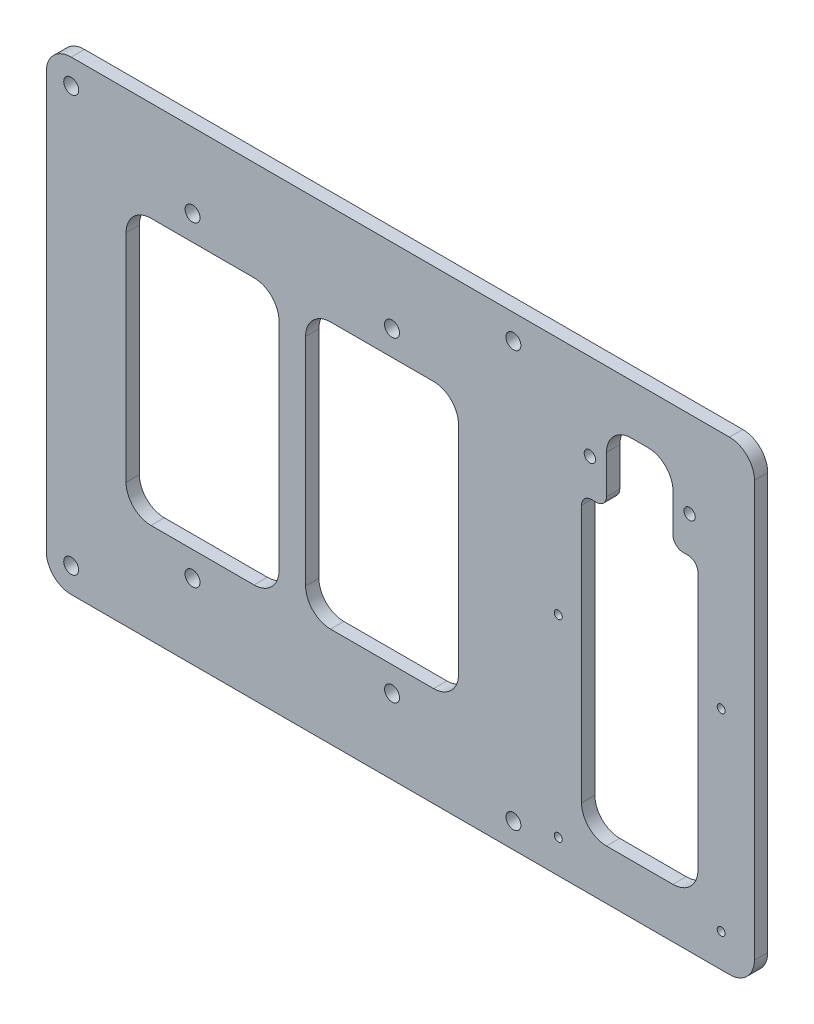
from build123d import *

# Parameters (mm, degrees)
SKETCH_1_W              = 140
SKETCH_1_H              = 148
SKETCH_1_W_2            = 80
SKETCH_1_H_2            = 46
EXTRUDE_1_DEPTH         = 4
HOLE_WIZARD_M4_1_D      = 4.5
HOLE_WIZARD_4_5_4_5_1_D = 4.5
SKETCH_9_W              = 65
SKETCH_9_H              = 140
EXTRUDE_3_DEPTH         = 4
HOLE_WIZARD_M2_1_D      = 2.4
CUT_EXTRUDE_1_DEPTH     = 255.921556562
HOLE_WIZARD_M3_1_D      = 3.4
FILLET_6_R              = 7.5
FILLET_8_R              = 3


with BuildPart() as part:
    # ｽｹｯﾁ1 → ﾎﾞｽ - 押し出し1 (new body)
    with BuildSketch(Plane(origin=(0, 0, 0), x_dir=(0, 1, 0), z_dir=(0, 0, 1))):
        with Locations((70, -74)):
            Rectangle(SKETCH_1_W, SKETCH_1_H)
        with Locations((70, -47)):
            Rectangle(SKETCH_1_W_2, SKETCH_1_H_2, mode=Mode.SUBTRACT)
        with Locations((70, -101)):
            Rectangle(SKETCH_1_W_2, SKETCH_1_H_2, mode=Mode.SUBTRACT)
    extrude(amount=EXTRUDE_1_DEPTH)

    # M4 すきま穴1 (through all)
    with Locations(Plane.XY.offset(4)):
        with Locations((7.5, 132.5), (140.5, 132.5), (7.5, 7.5), (140.5, 7.5)):
            Hole(HOLE_WIZARD_M4_1_D / 2)

    # Ø4.5 (4.5) 直径の穴1 (through all)
    with Locations(Plane.XY.offset(4)):
        with Locations((44, 117.5), (104, 117.5), (104, 22.5), (44, 22.5)):
            Hole(HOLE_WIZARD_4_5_4_5_1_D / 2)

    # ｽｹｯﾁ9 → ﾎﾞｽ - 押し出し3 (add)
    with BuildSketch(Plane.XY.offset(4)):
        with Locations((180.5, 70)):
            Rectangle(SKETCH_9_W, SKETCH_9_H)
    extrude(amount=-EXTRUDE_3_DEPTH)

    # M2 すきま穴1 (through all)
    with Locations(Plane.XY.offset(4)):
        with Locations((203, 10), (154, 68), (203, 68), (154, 10)):
            Hole(HOLE_WIZARD_M2_1_D / 2)

    # ｽｹｯﾁ13 → ｶｯﾄ - 押し出し1 (cut, through all)
    with BuildSketch(Plane.XY.offset(4)):
        Polygon((168.5, 125), (188.5, 125), (188.5, 103), (196, 103), (196, 15), (161, 15), (161, 103), (168.5, 103), align=None)
    extrude(amount=-CUT_EXTRUDE_1_DEPTH, mode=Mode.SUBTRACT)

    # M3 すきま穴1 (through all)
    with Locations(Plane.XY.offset(4)):
        with Locations((163.5, 114), (193.5, 114)):
            Hole(HOLE_WIZARD_M3_1_D / 2)

    # ﾌｨﾚｯﾄ6
    fillet_6_edges = [part.edges().sort_by_distance(p)[0] for p in [
        (168.5, 125, 2),
        (188.5, 125, 2),
        (196, 15, 2),
        (161, 15, 2),
        (24, 30, 2),
        (70, 30, 2),
        (70, 110, 2),
        (24, 110, 2),
        (124, 110, 2),
        (78, 110, 2),
        (78, 30, 2),
        (124, 30, 2),
        (0, 0, 2),
        (0, 140, 2),
        (213, 140, 2),
        (213, 0, 2),
    ]]
    fillet(fillet_6_edges, radius=FILLET_6_R)

    # ﾌｨﾚｯﾄ8
    fillet_8_edges = [part.edges().sort_by_distance(p)[0] for p in [
        (168.5, 103, 2),
        (188.5, 103, 2),
        (196, 103, 2),
        (161, 103, 2),
    ]]
    fillet(fillet_8_edges, radius=FILLET_8_R)


solid = part.part
